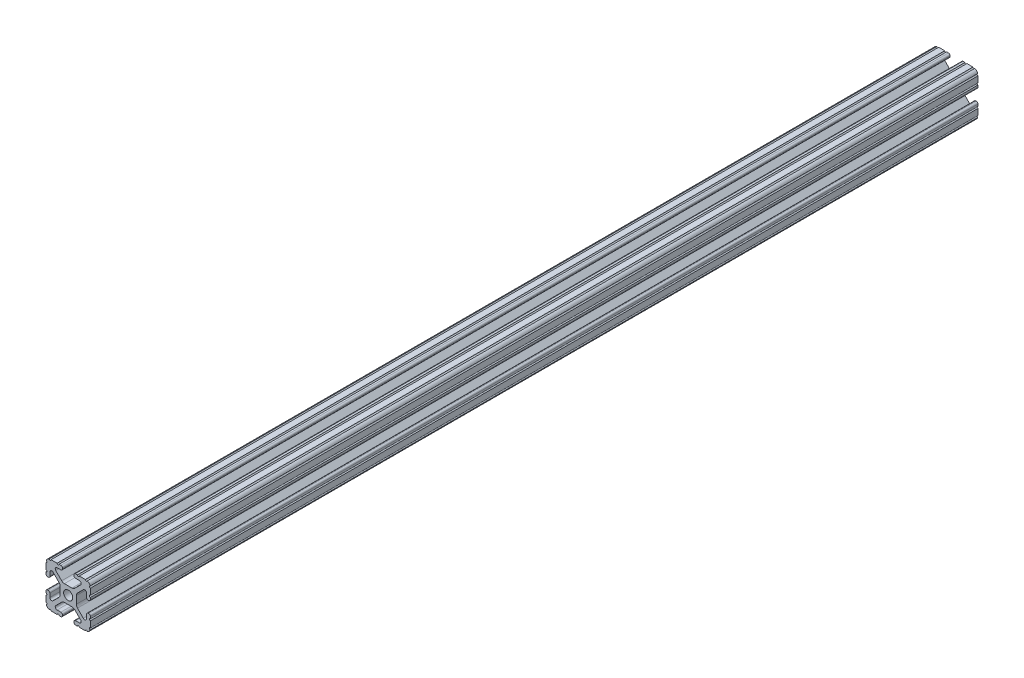
from build123d import *

# Parameters (mm, degrees)
BOSS_EXTRUDE1_DEPTH     = 1524
CUT_EXTRUDE1_DEPTH      = 1525.105829659
CUT_EXTRUDE1_DEPTH_BACK = 1525.105829659
SKETCH5_R               = 0.55245
CUT_EXTRUDE2_DEPTH      = 1525.105829659
CUT_EXTRUDE2_DEPTH_BACK = 1525.105829659
SKETCH8_W               = 50.559993734
SKETCH8_H               = 1231.9
CUT_EXTRUDE3_DEPTH      = 1525.105829659
CUT_EXTRUDE3_DEPTH_BACK = 1525.105829659
SKETCH9_W               = 50.679996867
SKETCH9_H               = 1333.5


with BuildPart() as part:
    # Sketch4 → Boss-Extrude1 (new, symmetric)
    with BuildSketch(Plane.XY):
        with BuildLine():
            Line((4.190365, -12.7), (10.11729625, -12.7))
            ThreePointArc((10.11729625, -12.7), (11.943543585, -11.943543585), (12.7, -10.11729625))
            Line((12.7, -10.11729625), (12.7, -4.190365))
            ThreePointArc((12.7, -4.190365), (12.42492494, -3.52627506), (11.760835, -3.2512))
            Line((11.760835, -3.2512), (11.429365, -3.2512))
            ThreePointArc((11.429365, -3.2512), (10.76527506, -3.52627506), (10.4902, -4.190365))
            Line((10.4902, -4.190365), (10.4902, -6.348478019))
            ThreePointArc((10.4902, -6.348478019), (9.830707141, -7.335478831), (8.666460301, -7.103895736))
            Line((8.666460301, -7.103895736), (5.299899128, -3.737334563))
            ThreePointArc((5.299899128, -3.737334563), (4.817571085, -3.015479634), (4.6482, -2.16399369))
            Line((4.6482, -2.16399369), (4.6482, 0))
            Line((4.6482, 0), (2.6035, 0))
            ThreePointArc((2.6035, 0), (1.840952505, -1.840952505), (0, -2.6035))
            Line((0, -2.6035), (0, -4.6482))
            Line((0, -4.6482), (2.16399369, -4.6482))
            ThreePointArc((2.16399369, -4.6482), (3.015479634, -4.817571085), (3.737334563, -5.299899128))
            Line((3.737334563, -5.299899128), (7.103895736, -8.666460301))
            ThreePointArc((7.103895736, -8.666460301), (7.335478831, -9.830707141), (6.348478019, -10.4902))
            Line((6.348478019, -10.4902), (4.190365, -10.4902))
            ThreePointArc((4.190365, -10.4902), (3.52627506, -10.76527506), (3.2512, -11.429365))
            Line((3.2512, -11.429365), (3.2512, -11.760835))
            ThreePointArc((3.2512, -11.760835), (3.52627506, -12.42492494), (4.190365, -12.7))
        make_face()
    extrude(amount=BOSS_EXTRUDE1_DEPTH, both=True)

    # Sketch5 → Cut-Extrude1 (cut, two sides: drawn at the far end of the back side and taken through both)
    with BuildSketch(Plane.XY.offset(-CUT_EXTRUDE1_DEPTH_BACK)):
        with Locations((10.356153152, -12.7)):
            Circle(SKETCH5_R)
        with Locations((5.796028019, -12.7)):
            Circle(SKETCH5_R)
        with Locations((12.7, -10.356153152)):
            Circle(SKETCH5_R)
        with Locations((12.7, -5.796028019)):
            Circle(SKETCH5_R)
    extrude(amount=CUT_EXTRUDE1_DEPTH + CUT_EXTRUDE1_DEPTH_BACK, mode=Mode.SUBTRACT)

    # Mirror1: part across plane


with BuildPart() as part_1:
    add(part.part)
    add(part.part.mirror(Plane(origin=(0, 0, 0), x_dir=(0, 0, 1), z_dir=(1, 0, 0))))

    # Mirror2: part across plane


with BuildPart() as part_2:
    add(part_1.part)
    add(part_1.part.mirror(Plane.ZX))

    # Sketch8 → Cut-Extrude2 (cut, two sides: drawn at the far end of the back side and taken through both)
    with BuildSketch(Plane(origin=(0, 0, 0), x_dir=(1, 0, 0), z_dir=(0, 1, 0)).offset(-CUT_EXTRUDE2_DEPTH_BACK)):
        with Locations((0, 920.75)):
            Rectangle(SKETCH8_W, SKETCH8_H)
    extrude(amount=CUT_EXTRUDE2_DEPTH + CUT_EXTRUDE2_DEPTH_BACK, mode=Mode.SUBTRACT)

    # Sketch9 → Cut-Extrude3 (cut, two sides: drawn at the far end of the back side and taken through both)
    with BuildSketch(Plane(origin=(0, 0, 0), x_dir=(1, 0, 0), z_dir=(0, 1, 0)).offset(-CUT_EXTRUDE3_DEPTH_BACK)):
        with Locations((-0.060001567, -349.25)):
            Rectangle(SKETCH9_W, SKETCH9_H)
    extrude(amount=CUT_EXTRUDE3_DEPTH + CUT_EXTRUDE3_DEPTH_BACK, mode=Mode.SUBTRACT)


solid = part_2.part
